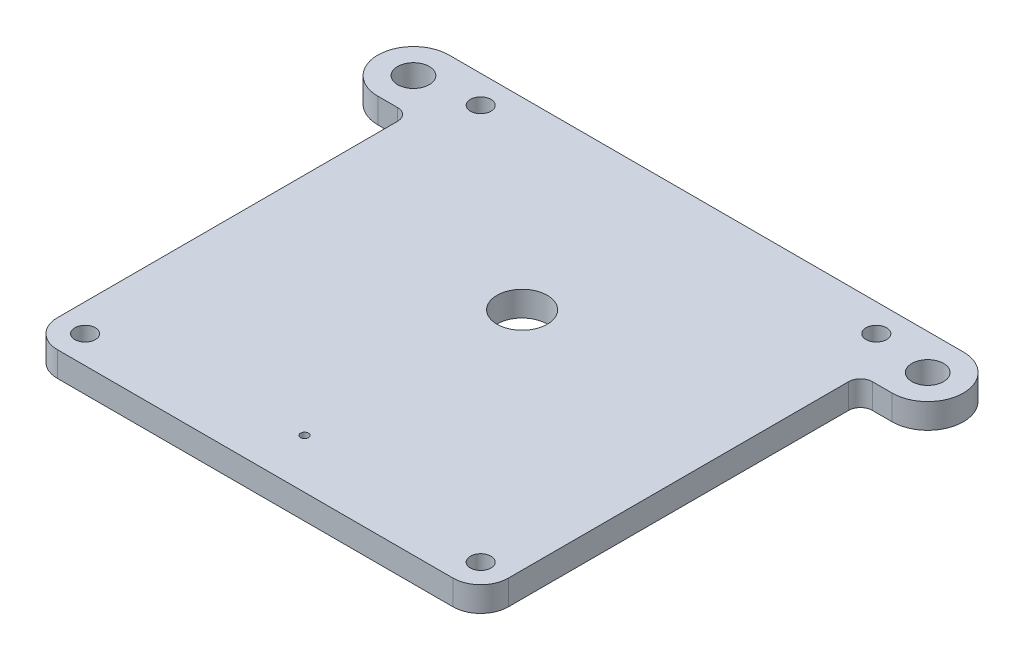
from build123d import *

# Parameters (mm, degrees)
SKETCH1_R           = 2.6
SKETCH1_R_2         = 4
SKETCH1_R_3         = 6.35
SKETCH1_R_4         = 1
BOSS_EXTRUDE2_DEPTH = 6.3


with BuildPart() as part:
    # Sketch1 → Boss-Extrude2 (new body)
    with BuildSketch(Plane(origin=(0, 0, 0), x_dir=(1, 0, 0), z_dir=(0, 1, 0))):
        with BuildLine():
            Line((-65, 0), (65, 0))
            ThreePointArc((65, 0), (74, -9), (65, -18))
            Line((65, -18), (60, -18))
            ThreePointArc((60, -18), (57.878679656, -18.878679656), (57, -21))
            Line((57, -21), (57, -107))
            ThreePointArc((57, -107), (54.949747468, -111.949747468), (50, -114))
            Line((50, -114), (-50, -114))
            ThreePointArc((-50, -114), (-54.949747468, -111.949747468), (-57, -107))
            Line((-57, -107), (-57, -21))
            ThreePointArc((-57, -21), (-57.878679656, -18.878679656), (-60, -18))
            Line((-60, -18), (-65, -18))
            ThreePointArc((-65, -18), (-74, -9), (-65, 0))
        make_face()
        with Locations(Location((-50, -107, 0), (0, 0, 90))):
            Circle(SKETCH1_R, mode=Mode.SUBTRACT)
        with Locations(Location((50, -7, 0), (0, 0, 270))):
            Circle(SKETCH1_R, mode=Mode.SUBTRACT)
        with Locations(Location((65, -9, 0), (0, 0, 270))):
            Circle(SKETCH1_R_2, mode=Mode.SUBTRACT)
        with Locations(Location((50, -107, 0), (0, 0, 270))):
            Circle(SKETCH1_R, mode=Mode.SUBTRACT)
        with Locations(Location((0, -46.527767497, 0), (0, 0, 270))):
            Circle(SKETCH1_R_3, mode=Mode.SUBTRACT)
        with Locations(Location((0, -101.527767497, 0), (0, 0, 270))):
            Circle(SKETCH1_R_4, mode=Mode.SUBTRACT)
        with Locations(Location((-65, -9, 0), (0, 0, 90))):
            Circle(SKETCH1_R_2, mode=Mode.SUBTRACT)
        with Locations(Location((-50, -7, 0), (0, 0, 90))):
            Circle(SKETCH1_R, mode=Mode.SUBTRACT)
    extrude(amount=BOSS_EXTRUDE2_DEPTH)


solid = part.part
